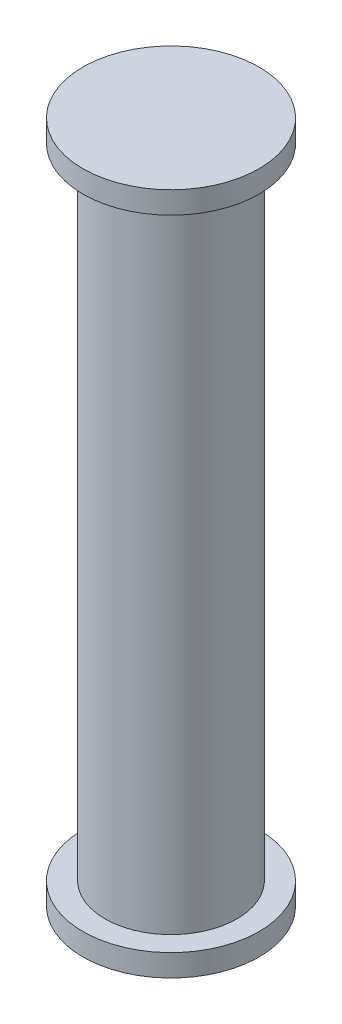
from build123d import *

# Parameters (mm, degrees)
SKETCH1_R           = 3
BOSS_EXTRUDE1_DEPTH = 30
SKETCH2_R           = 4
BOSS_EXTRUDE2_DEPTH = 1
SKETCH3_R           = 4
BOSS_EXTRUDE3_DEPTH = 1


with BuildPart() as part:
    # Sketch1 → Boss-Extrude1 (new body)
    with BuildSketch(Plane(origin=(0, 0, 0), x_dir=(1, 0, 0), z_dir=(0, 1, 0))):
        with Locations(Location((0, 0, 0), (0, 0, 270))):
            Circle(SKETCH1_R)
    extrude(amount=-BOSS_EXTRUDE1_DEPTH)

    # Sketch2 → Boss-Extrude2 (add)
    with BuildSketch(Plane(origin=(0, 0, 0), x_dir=(1, 0, 0), z_dir=(0, 1, 0))):
        with Locations(Location((0, 0, 0), (0, 0, 270))):
            Circle(SKETCH2_R)
    extrude(amount=-BOSS_EXTRUDE2_DEPTH)

    # Sketch3 → Boss-Extrude3 (add)
    with BuildSketch(Plane.XZ.offset(30)):
        with Locations(Location((0, 0, 0), (0, 0, 90))):
            Circle(SKETCH3_R)
    extrude(amount=BOSS_EXTRUDE3_DEPTH)


solid = part.part
